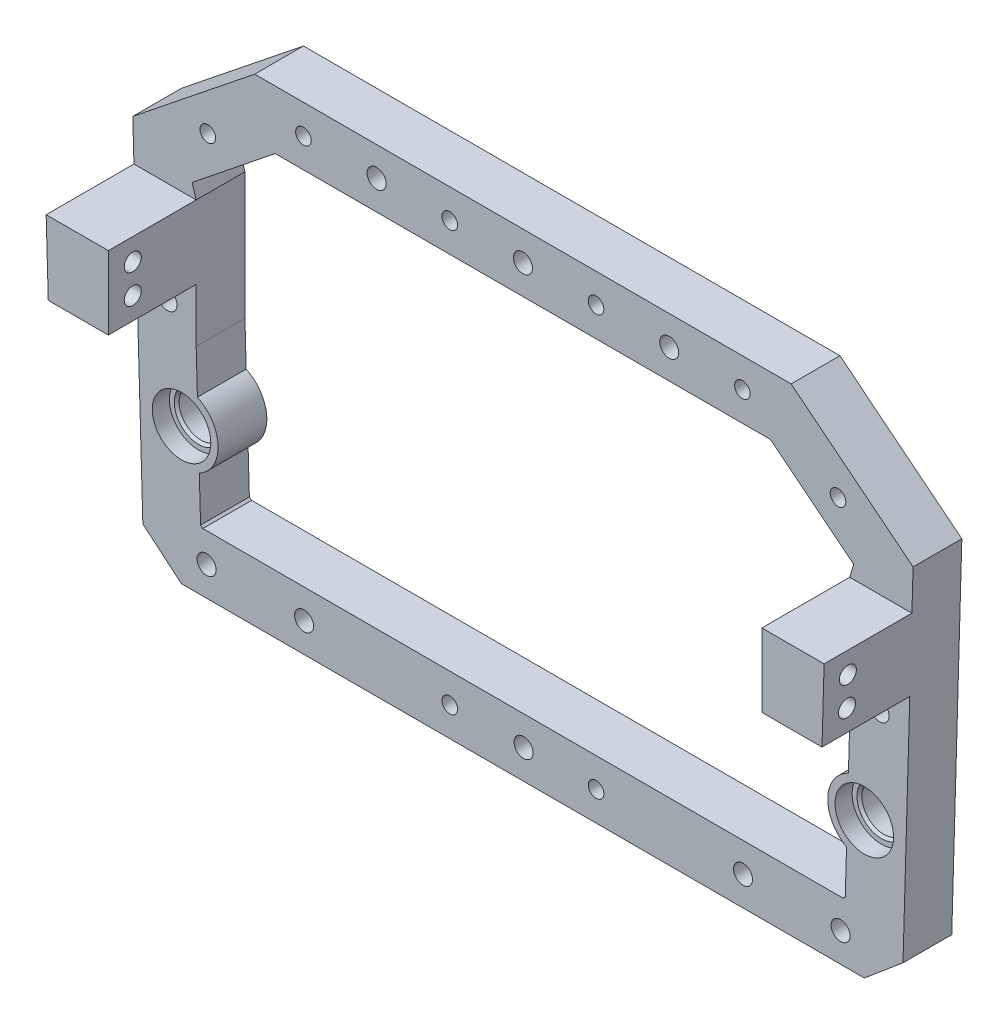
from build123d import *

# Parameters (mm, degrees)
SKETCH1_R               = 6
SKETCH1_R_2             = 1.6
BOSS_EXTRUDE1_DEPTH     = 10
BOSS_EXTRUDE2_DEPTH     = 18
CUT_EXTRUDE4_DEPTH      = 158.468876617
CUT_EXTRUDE4_DEPTH_BACK = 158.468876617
SKETCH7_R               = 1.75
SKETCH8_R               = 2.65
CUT_EXTRUDE5_DEPTH      = 3.5
BOSS_EXTRUDE3_START     = -10
SKETCH10_R              = 6.870136932
SKETCH10_R_2            = 4.5
SKETCH10_R_3            = 6.9172188
BOSS_EXTRUDE3_DEPTH     = 6.5
SKETCH11_R              = 1.95
CUT_EXTRUDE6_DEPTH      = 99.023132373
CHAMFER1_SIZE           = 0.5


with BuildPart() as part:
    # Sketch1 → Boss-Extrude1 (new body)
    with BuildSketch(Plane.XY):
        Polygon((-55.131687722, 48.97503592), (54.868312278, 48.97503592), (79.868312278, 28.97503592), (77.800969503, -42.368674328), (69.868312278, -49.02496408), (-70.131687722, -49.02496408), (-78.064344947, -42.368674328), (-80.131687722, 28.97503592), align=None)
        with Locations((-70.131687722, -21.02496408)):
            Circle(SKETCH1_R, mode=Mode.SUBTRACT)
        with Locations((69.868312278, -21.02496408)):
            Circle(SKETCH1_R, mode=Mode.SUBTRACT)
        with Locations((-45.131687722, 42.97503592)):
            Circle(SKETCH1_R_2, mode=Mode.SUBTRACT)
        with Locations((-15.131687722, 42.97503592)):
            Circle(SKETCH1_R_2, mode=Mode.SUBTRACT)
        with Locations((14.868312278, 42.97503592)):
            Circle(SKETCH1_R_2, mode=Mode.SUBTRACT)
        with Locations((44.868312278, 42.97503592)):
            Circle(SKETCH1_R_2, mode=Mode.SUBTRACT)
        with Locations((-64.740033508, 33.604610207)):
            Circle(SKETCH1_R_2, mode=Mode.SUBTRACT)
        with Locations((64.476658063, 33.604610207)):
            Circle(SKETCH1_R_2, mode=Mode.SUBTRACT)
        with Locations((-15.131687722, -43.02496408)):
            Circle(SKETCH1_R_2, mode=Mode.SUBTRACT)
        with Locations((14.868312278, -43.02496408)):
            Circle(SKETCH1_R_2, mode=Mode.SUBTRACT)
        with BuildLine():
            Line((-67.963425231, 23.342147743), (-50.92231501, 36.97503592))
            Line((-50.92231501, 36.97503592), (50.658939565, 36.97503592))
            Line((50.658939565, 36.97503592), (67.700049787, 23.342147743))
            Line((67.700049787, 23.342147743), (66.868312278, 20.639002542))
            Line((66.868312278, 20.639002542), (66.868312278, -5.360997458))
            Line((66.868312278, -5.360997458), (66.610164686, -14.269634756))
            ThreePointArc((66.610164686, -14.269634756), (62.371459095, -20.807726075), (66.224458755, -27.580292561))
            Line((66.224458755, -27.580292561), (65.961995417, -36.637865644))
            Line((65.961995417, -36.637865644), (65.500669466, -37.02496408))
            Line((65.500669466, -37.02496408), (-65.764044911, -37.02496408))
            Line((-65.764044911, -37.02496408), (-66.225370862, -36.637865644))
            Line((-66.225370862, -36.637865644), (-66.487834199, -27.580292561))
            ThreePointArc((-66.487834199, -27.580292561), (-62.634834539, -20.807726075), (-66.873540131, -14.269634756))
            Line((-66.873540131, -14.269634756), (-67.131687722, -5.360997458))
            Line((-67.131687722, -5.360997458), (-67.131687722, 20.639002542))
            Line((-67.131687722, 20.639002542), (-67.963425231, 23.342147743))
        make_face(mode=Mode.SUBTRACT)
    extrude(amount=BOSS_EXTRUDE1_DEPTH)

    # Sketch5 → Boss-Extrude2 (add)
    with BuildSketch(Plane.XY.offset(10)):
        Polygon((66.868312278, 20.639002542), (79.192098778, 20.639002542), (79.626757159, 20.639002542), (79.192098778, 5.639002542), (66.868312278, 5.639002542), align=None)
        Polygon((-79.890132604, 20.639002542), (-79.455474222, 5.639002542), (-67.131687722, 5.639002542), (-67.131687722, 20.639002542), (-79.455474222, 20.639002542), align=None)
    extrude(amount=BOSS_EXTRUDE2_DEPTH)

    # Sketch7 → Cut-Extrude4 (cut, two sides: drawn at the far end of the back side and taken through both)
    with BuildSketch(Plane(origin=(-67.131687722, 0, 0), x_dir=(0, 0, -1), z_dir=(1, 0, 0)).offset(-CUT_EXTRUDE4_DEPTH_BACK)):
        with Locations(Location((-23, 16.139002542, 0), (0, 0, 90))):
            Circle(SKETCH7_R)
        with Locations(Location((-23, 10.139002542, 0), (0, 0, 90))):
            Circle(SKETCH7_R)
    extrude(amount=CUT_EXTRUDE4_DEPTH + CUT_EXTRUDE4_DEPTH_BACK, mode=Mode.SUBTRACT)

    # Sketch8 → Cut-Extrude5 (cut)
    with BuildSketch(Plane(origin=(0, 0, 0), x_dir=(-1, 0, 0), z_dir=(0, 0, -1))):
        with Locations((-14.868312278, 42.97503592)):
            Circle(SKETCH8_R)
        with Locations((15.131687722, 42.97503592)):
            Circle(SKETCH8_R)
        with Locations((45.131687722, 42.97503592)):
            Circle(SKETCH8_R)
        with Locations((64.740033508, 33.604610207)):
            Circle(SKETCH8_R)
        with Locations((-64.476658063, 33.604610207)):
            Circle(SKETCH8_R)
        with Locations((-44.868312278, 42.97503592)):
            Circle(SKETCH8_R)
        with Locations((-14.868312278, -43.02496408)):
            Circle(SKETCH8_R)
        with Locations((15.131687722, -43.02496408)):
            Circle(SKETCH8_R)
    extrude(amount=-CUT_EXTRUDE5_DEPTH, mode=Mode.SUBTRACT)

    # Sketch10 → Boss-Extrude3 (add)
    # profile 1 of 2: a face of its own
    with BuildSketch(Plane.XY.offset(10).offset(BOSS_EXTRUDE3_START)):
        with Locations((-70.131687722, -21.02496408)):
            Circle(SKETCH10_R)
        with Locations(Location((-70.131687722, -21.02496408, 0), (0, 0, 180))):
            Circle(SKETCH10_R_2, mode=Mode.SUBTRACT)
    # profile 2 of 2: a face of its own
    with BuildSketch(Plane.XY.offset(10).offset(BOSS_EXTRUDE3_START)):
        with Locations((69.868312278, -21.02496408)):
            Circle(SKETCH10_R_3)
        with Locations(Location((69.868312278, -21.02496408, 0), (0, 0, 180))):
            Circle(SKETCH10_R_2, mode=Mode.SUBTRACT)
    extrude(amount=BOSS_EXTRUDE3_DEPTH)

    # Sketch11 → Cut-Extrude6 (cut, through all)
    with BuildSketch(Plane(origin=(0, 0, 0), x_dir=(-1, 0, 0), z_dir=(0, 0, -1))):
        with Locations((-29.868312278, 42.97503592)):
            Circle(SKETCH11_R)
        with Locations((0.131687722, 42.97503592)):
            Circle(SKETCH11_R)
        with Locations((30.131687722, 42.97503592)):
            Circle(SKETCH11_R)
        with Locations((0, -43.02496408)):
            Circle(SKETCH11_R)
        with Locations((-45, -43.02496408)):
            Circle(SKETCH11_R)
        with Locations((45, -43.02496408)):
            Circle(SKETCH11_R)
        with Locations((-65, -43.02496408)):
            Circle(SKETCH11_R)
        with Locations((65, -43.02496408)):
            Circle(SKETCH11_R)
        with Locations((-73, 0)):
            Circle(SKETCH11_R)
        with Locations((73, 0)):
            Circle(SKETCH11_R)
    extrude(amount=-CUT_EXTRUDE6_DEPTH, mode=Mode.SUBTRACT)

    # Chamfer1
    chamfer1_edges = [part.edges().sort_by_distance(p)[0] for p in [
        (74.368312278, -21.02496408, 6.5),
        (-65.631687722, -21.02496408, 6.5),
    ]]
    chamfer(chamfer1_edges, length=CHAMFER1_SIZE)


solid = part.part
